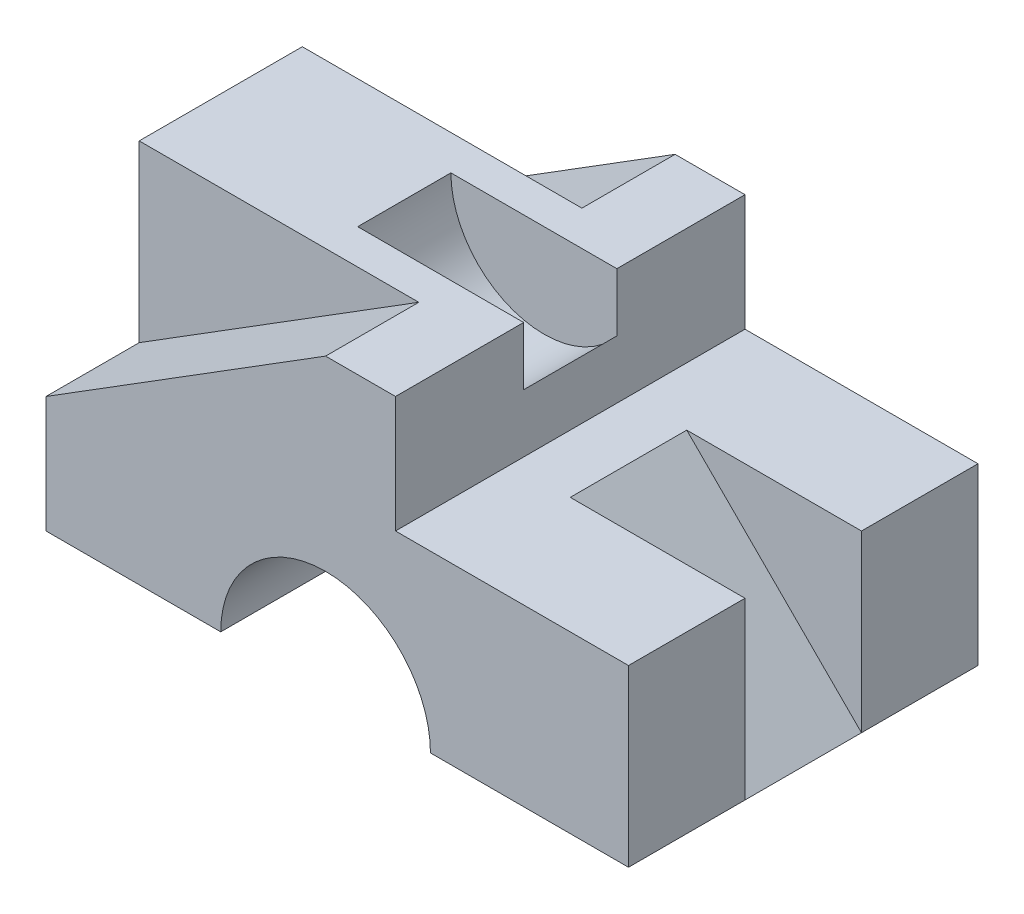
from build123d import *

# Parameters (mm, degrees)
BOSS_EXTRUDE1_DEPTH = 30
CUT_EXTRUDE1_DEPTH  = 16
CUT_EXTRUDE3_DEPTH  = 8
CUT_EXTRUDE4_DEPTH  = 10


with BuildPart() as part:
    # Sketch1 → Boss-Extrude1 (new, symmetric)
    with BuildSketch(Plane.XY):
        with BuildLine():
            Line((0, 0), (0, 20))
            Line((0, 20), (0, 50))
            Line((0, 50), (48, 50))
            Line((48, 50), (60, 50))
            Line((60, 50), (60, 30))
            Line((60, 30), (100, 30))
            Line((100, 30), (100, 0))
            Line((100, 0), (66, 0))
            ThreePointArc((66, 0), (48, 18), (30, 0))
            Line((30, 0), (0, 0))
        make_face()
    extrude(amount=BOSS_EXTRUDE1_DEPTH, both=True)

    # Sketch2 → Cut-Extrude1 (cut)
    with BuildSketch(Plane.XY.offset(30)):
        Polygon((0, 20), (48, 50), (0, 50), align=None)
    cut_extrude1 = extrude(amount=-CUT_EXTRUDE1_DEPTH, mode=Mode.SUBTRACT)

    # Mirror1: Cut-Extrude1 across plane
    add(cut_extrude1.mirror(Plane.XY), mode=Mode.SUBTRACT)

    # Sketch4 → Cut-Extrude3 (cut, symmetric)
    with BuildSketch(Plane.XY):
        with BuildLine():
            Line((60, 50), (31.510004003, 50))
            ThreePointArc((31.510004003, 50), (42.210944462, 34.902981487), (60, 40))
            Line((60, 40), (60, 50))
        make_face()
    extrude(amount=CUT_EXTRUDE3_DEPTH, both=True, mode=Mode.SUBTRACT)

    # Sketch5 → Cut-Extrude4 (cut, symmetric)
    with BuildSketch(Plane.XY):
        Polygon((100, 0), (100, 30), (70, 30), align=None)
    extrude(amount=CUT_EXTRUDE4_DEPTH, both=True, mode=Mode.SUBTRACT)


solid = part.part
